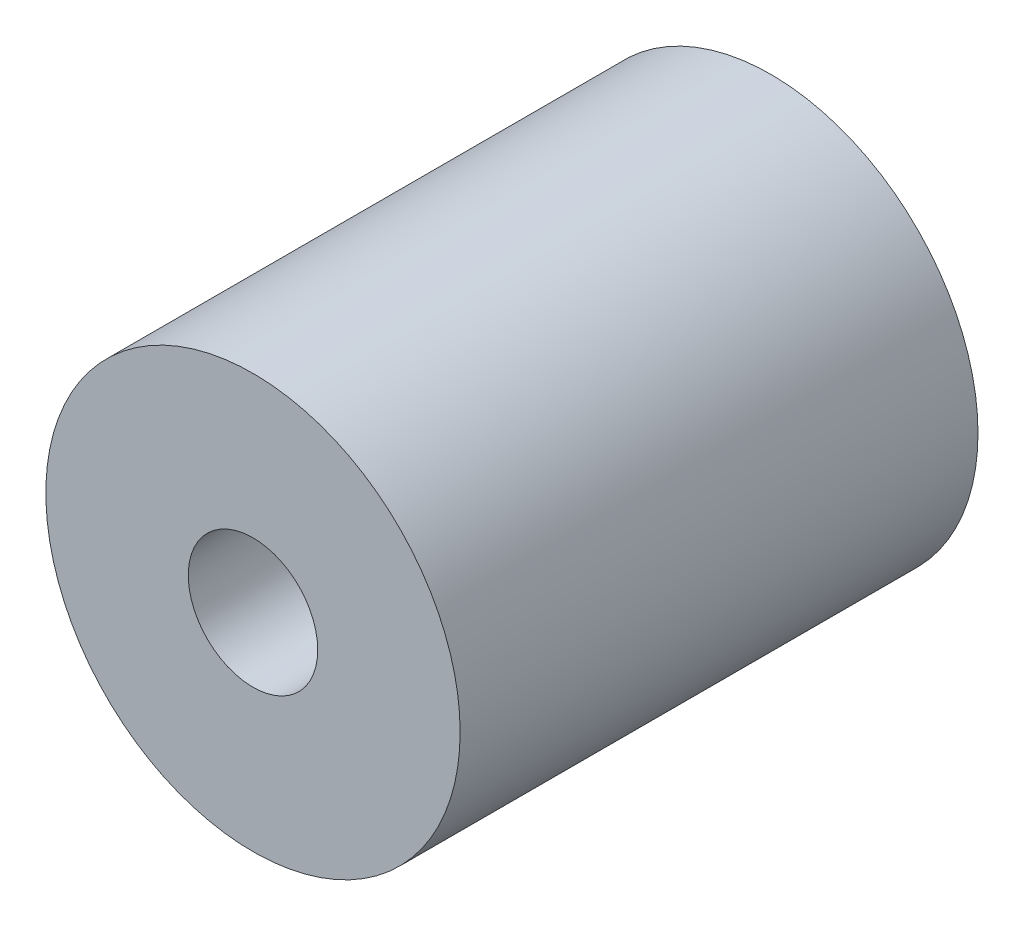
from build123d import *

# Parameters (mm, degrees)
SKETCH_1_R      = 4
EXTRUDE_1_DEPTH = 10
M3X0_5_1_D      = 2.5


with BuildPart() as part:
    # 草图1 → 凸台-拉伸1 (new body)
    with BuildSketch(Plane.XY):
        Circle(SKETCH_1_R)
    extrude(amount=EXTRUDE_1_DEPTH)

    # M3x0.5 螺纹孔1 (through all)
    with Locations(Plane.XY.offset(10)):
        with Locations((0, 0)):
            Hole(M3X0_5_1_D / 2)


solid = part.part
